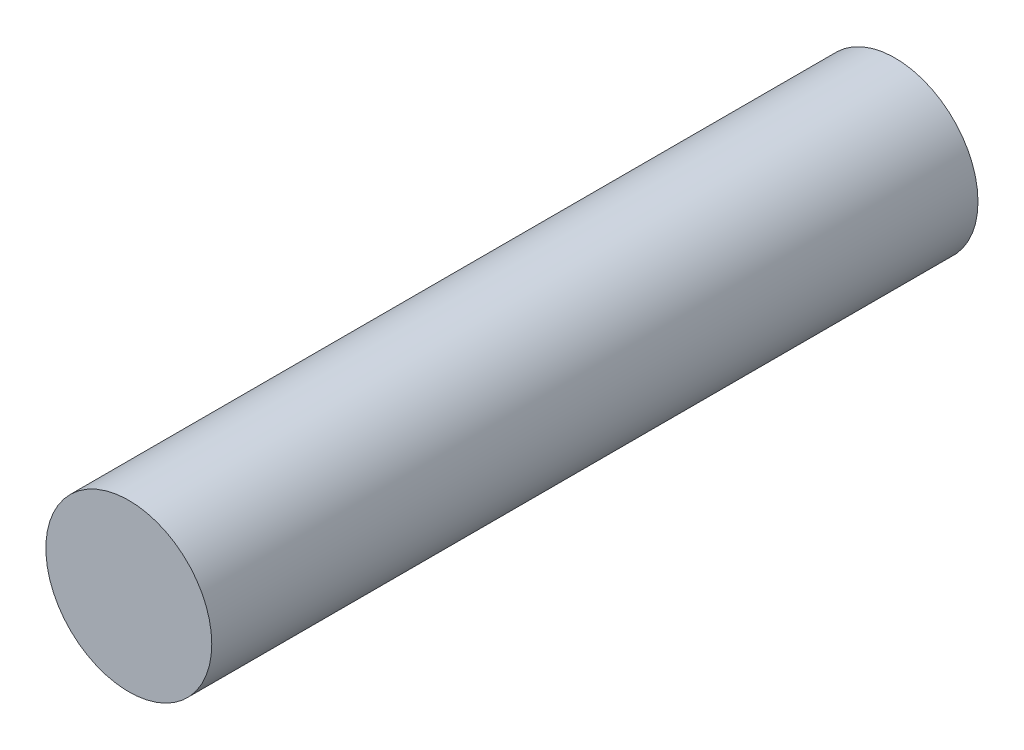
from build123d import *

# Parameters (mm, degrees)
SKETCH_1_R           = 2
CABLE_ENVELOPE_DEPTH = 18.47


with BuildPart() as part:
    # 草图1 → Cable_envelope (new body)
    with BuildSketch(Plane.XY):
        Circle(SKETCH_1_R)
    extrude(amount=CABLE_ENVELOPE_DEPTH)


solid = part.part
